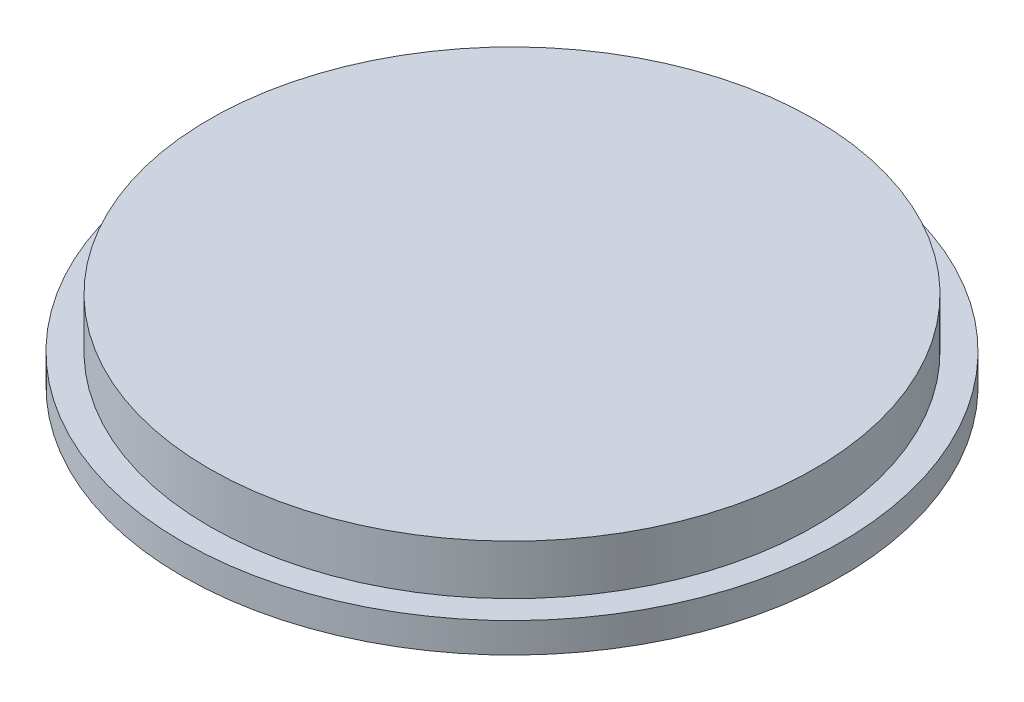
from build123d import *

# Parameters (mm, degrees)
SKETCH1_R           = 33.1
BOSS_EXTRUDE1_DEPTH = 3
SKETCH2_R           = 30.4
BOSS_EXTRUDE2_DEPTH = 5


with BuildPart() as part:
    # Sketch1 → Boss-Extrude1 (new body)
    with BuildSketch(Plane(origin=(0, 0, 0), x_dir=(1, 0, 0), z_dir=(0, 1, 0))):
        with Locations(Location((0, 0, 0), (0, 0, 270))):
            Circle(SKETCH1_R)
    extrude(amount=BOSS_EXTRUDE1_DEPTH)

    # Sketch2 → Boss-Extrude2 (add)
    with BuildSketch(Plane(origin=(0, 3, 0), x_dir=(1, 0, 0), z_dir=(0, 1, 0))):
        with Locations(Location((0, 0, 0), (0, 0, 270))):
            Circle(SKETCH2_R)
    extrude(amount=BOSS_EXTRUDE2_DEPTH)


solid = part.part
